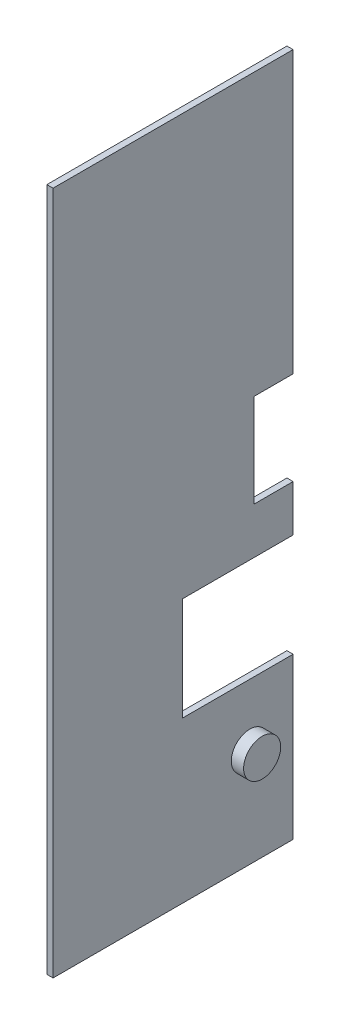
from build123d import *

# Parameters (mm, degrees)
SKETCH_1_W          = 110.7
SKETCH_1_H          = 38.85
EXTRUDE_1_DEPTH     = 0.5
SKETCH_2_W          = 38.85
SKETCH_2_H          = 110.7
EXTRUDE_2_DEPTH     = 0.5
SKETCH_3_W          = 17.932827047
SKETCH_3_H          = 16.708777413
CUT_EXTRUDE_1_DEPTH = 10
SKETCH_4_W          = 6.338485403
SKETCH_4_H          = 15.09561221
CUT_EXTRUDE_2_DEPTH = 3
SKETCH_5_R          = 1.379738623
CUT_EXTRUDE_3_DEPTH = 3
SKETCH_6_R          = 3.000043017
SKETCH_6_R_2        = 2.273503066
EXTRUDE_3_DEPTH     = 1
SKETCH_7_R          = 3.000043017
EXTRUDE_4_DEPTH     = 1


with BuildPart() as part:
    # Эскиз1 → Бобышка-Вытянуть1 (new body)
    with BuildSketch(Plane(origin=(0.5, 0, 0), x_dir=(0, -1, 0), z_dir=(-1, 0, 0))):
        with Locations((-45.5, 22.825)):
            Rectangle(SKETCH_1_W, SKETCH_1_H)
    extrude(amount=-EXTRUDE_1_DEPTH)

    # Эскиз2 → Бобышка-Вытянуть2 (add)
    with BuildSketch(Plane.ZY.offset(-0.5)):
        with Locations((22.825, 45.5)):
            Rectangle(SKETCH_2_W, SKETCH_2_H)
    extrude(amount=EXTRUDE_2_DEPTH)

    # Эскиз3 → Вырез-Вытянуть1 (cut)
    with BuildSketch(Plane.ZY):
        with Locations((12.366413524, 24.461489881)):
            Rectangle(SKETCH_3_W, SKETCH_3_H)
    extrude(amount=-CUT_EXTRUDE_1_DEPTH, mode=Mode.SUBTRACT)

    # Эскиз4 → Вырез-Вытянуть2 (cut)
    with BuildSketch(Plane.ZY):
        with Locations((6.569242702, 47.853484542)):
            Rectangle(SKETCH_4_W, SKETCH_4_H)
    extrude(amount=-CUT_EXTRUDE_2_DEPTH, mode=Mode.SUBTRACT)

    # Эскиз5 → Вырез-Вытянуть3 (cut)
    with BuildSketch(Plane.ZY):
        with Locations((10.410414675, 6.109972629)):
            Circle(SKETCH_5_R)
    extrude(amount=-CUT_EXTRUDE_3_DEPTH, mode=Mode.SUBTRACT)

    # Эскиз6 → Бобышка-Вытянуть3 (add)
    with BuildSketch(Plane(origin=(1, 0, 0), x_dir=(0, 0, -1), z_dir=(1, 0, 0))):
        with Locations(Location((-10.410414675, 6.109972629, 0), (0, 0, 180))):
            Circle(SKETCH_6_R)
        with Locations((-10.410414675, 6.109972629)):
            Circle(SKETCH_6_R_2, mode=Mode.SUBTRACT)
    extrude(amount=EXTRUDE_3_DEPTH)

    # Эскиз7 → Бобышка-Вытянуть4 (add)
    with BuildSketch(Plane(origin=(2, 0, 0), x_dir=(0, 0, -1), z_dir=(1, 0, 0))):
        with Locations(Location((-10.410414675, 6.109972629, 0), (0, 0, 180))):
            Circle(SKETCH_7_R)
    extrude(amount=EXTRUDE_4_DEPTH)


solid = part.part
